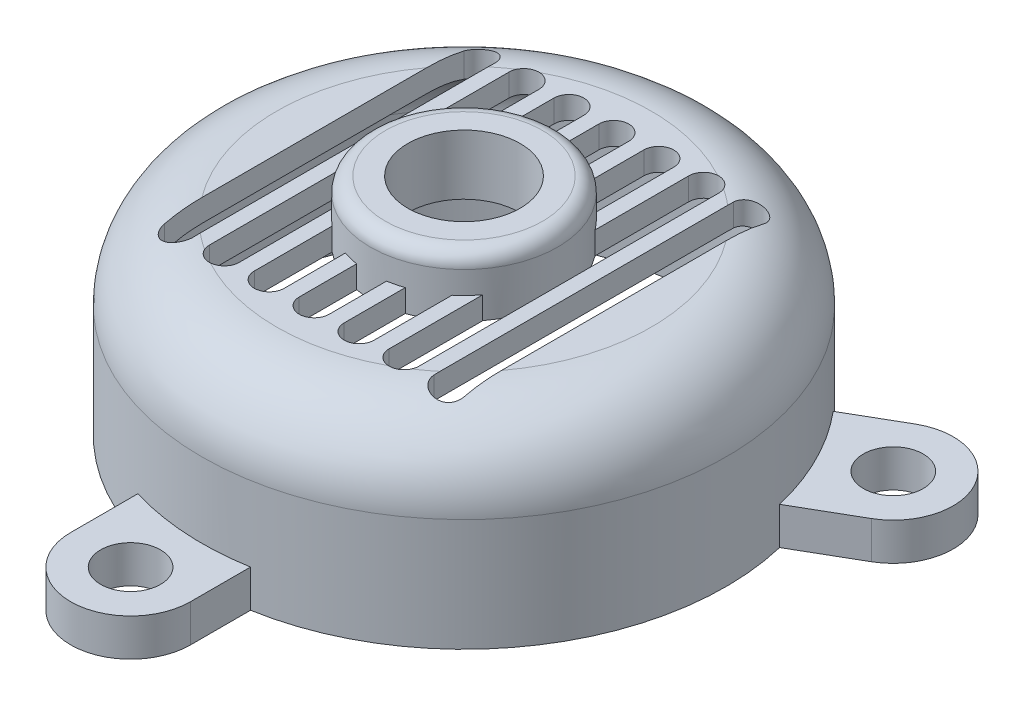
from build123d import *

# Parameters (mm, degrees)
SKETCH1_R                = 35
BOSS_EXTRUDE1_DEPTH      = 25
FILLET1_R                = 10
SHELL1_T                 = -3
SKETCH2_R                = 4
BOSS_EXTRUDE2_DEPTH      = 5
CIRPATTERN1_COUNT        = 3
CUT_EXTRUDE2_DEPTH       = 5
LPATTERN2_COUNT          = 7
LPATTERN2_PITCH          = 6
BOSS_EXTRUDE3_DEPTH      = 5
BOSS_EXTRUDE3_DEPTH_BACK = 3
SKETCH8_R                = 12.5
FILLET2_R                = 2
SKETCH9_R                = 7.5
CUT_EXTRUDE3_DEPTH       = 75.49391866


with BuildPart() as part:
    # Sketch1 → Boss-Extrude1 (new body)
    with BuildSketch(Plane(origin=(0, 0, 0), x_dir=(1, 0, 0), z_dir=(0, 1, 0))):
        with Locations(Location((0, 0, 0), (0, 0, 270))):
            Circle(SKETCH1_R)
    extrude(amount=BOSS_EXTRUDE1_DEPTH)

    # Fillet1
    fillet1_edges = [part.edges().sort_by_distance(p)[0] for p in [
        (0, 25, -35),
    ]]
    fillet(fillet1_edges, radius=FILLET1_R)

    # Shell1
    shell1_openings = [part.faces().sort_by_distance(p)[0] for p in [
        (0, 0, 0),
    ]]
    offset(amount=SHELL1_T, openings=shell1_openings, kind=Kind.INTERSECTION)

    # Sketch2 → Boss-Extrude2 (add)
    with BuildSketch(Plane.XZ):
        with BuildLine():
            Line((-10.019580099, 42.5), (-10.019580099, 32))
            Line((-10.019580099, 32), (5.980419901, 32))
            Line((5.980419901, 32), (5.980419901, 42.5))
            ThreePointArc((5.980419901, 42.5), (-2.019580099, 50.5), (-10.019580099, 42.5))
        make_face()
        with Locations(Location((-2.019580099, 42.5, 0), (0, 0, 270))):
            Circle(SKETCH2_R, mode=Mode.SUBTRACT)
    boss_extrude2 = extrude(amount=-BOSS_EXTRUDE2_DEPTH)

    # CirPattern1: Boss-Extrude2 ×3 about axis
    cirpattern1_axis = Axis((0, 0, 0), (0, 1, 0))
    for i in range(1, CIRPATTERN1_COUNT):
        add(boss_extrude2.rotate(cirpattern1_axis, i * 360 / CIRPATTERN1_COUNT))

    # Sketch3 → Cut-Extrude2 (cut)
    with BuildSketch(Plane(origin=(0, 25, 0), x_dir=(1, 0, 0), z_dir=(0, 1, 0))):
        with BuildLine():
            Line((-16, 20), (-16, -20))
            ThreePointArc((-16, -20), (-18, -22), (-20, -20))
            Line((-20, -20), (-20, 20))
            ThreePointArc((-20, 20), (-18, 22), (-16, 20))
        make_face()
    cut_extrude2 = extrude(amount=-CUT_EXTRUDE2_DEPTH, mode=Mode.SUBTRACT)

    # LPattern2: Cut-Extrude2 ×7
    with Locations(*[(i * LPATTERN2_PITCH, 0, 0) for i in range(1, LPATTERN2_COUNT)]):
        add(cut_extrude2, mode=Mode.SUBTRACT)

    # Sketch8 → Boss-Extrude3 (add, two sides: drawn at the far end of the back side and taken through both)
    with BuildSketch(Plane(origin=(0, 25, 0), x_dir=(1, 0, 0), z_dir=(0, 1, 0)).offset(-BOSS_EXTRUDE3_DEPTH_BACK)):
        with Locations(Location((0, 0, 0), (0, 0, 270))):
            Circle(SKETCH8_R)
    extrude(amount=BOSS_EXTRUDE3_DEPTH + BOSS_EXTRUDE3_DEPTH_BACK)

    # Fillet2
    fillet2_edges = [part.edges().sort_by_distance(p)[0] for p in [
        (0, 30, -12.5),
    ]]
    fillet(fillet2_edges, radius=FILLET2_R)

    # Sketch9 → Cut-Extrude3 (cut, through all)
    with BuildSketch(Plane(origin=(0, 30, 0), x_dir=(1, 0, 0), z_dir=(0, 1, 0))):
        with Locations(Location((0, 0, 0), (0, 0, 270))):
            Circle(SKETCH9_R)
    extrude(amount=-CUT_EXTRUDE3_DEPTH, mode=Mode.SUBTRACT)


solid = part.part
